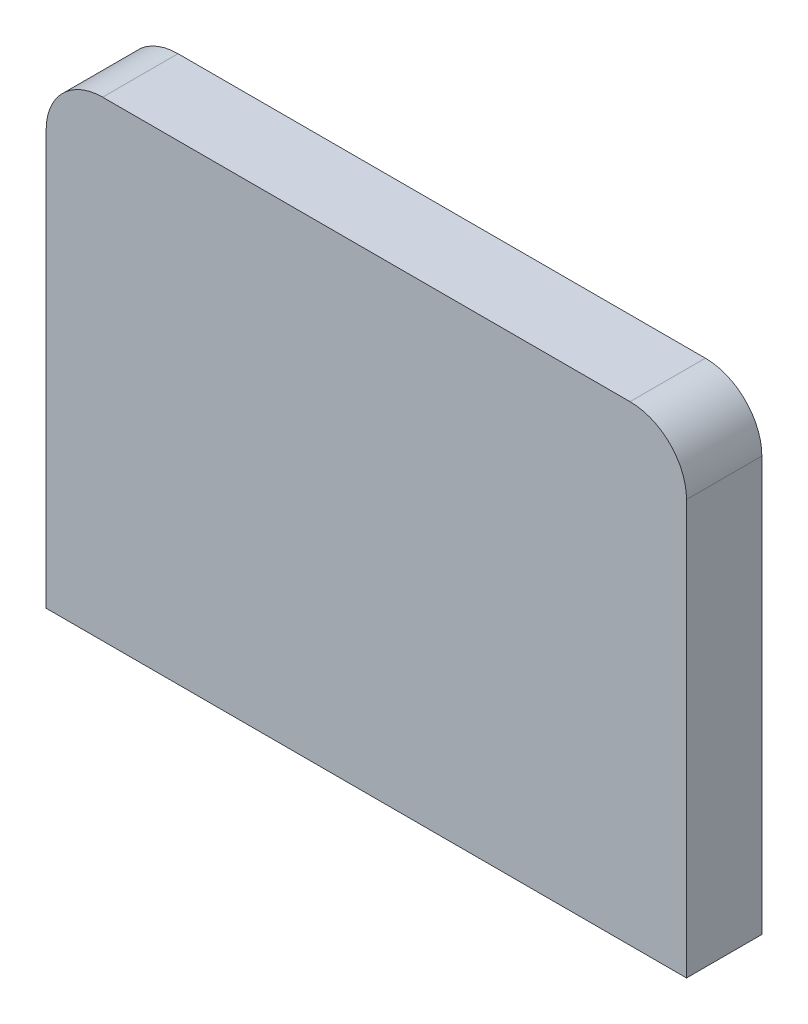
from build123d import *

# Parameters (mm, degrees)
SKETCH1_W           = 43.18
SKETCH1_H           = 31.75
BOSS_EXTRUDE1_DEPTH = 5.08
FILLET1_R           = 3.81


with BuildPart() as part:
    # Sketch1 → Boss-Extrude1 (new body)
    with BuildSketch(Plane.XY):
        with Locations((-29.043861199, 15.675265785)):
            Rectangle(SKETCH1_W, SKETCH1_H)
    extrude(amount=BOSS_EXTRUDE1_DEPTH)

    # Fillet1
    fillet1_edges = [part.edges().sort_by_distance(p)[0] for p in [
        (-50.633861199, 31.550265785, 2.54),
        (-7.453861199, 31.550265785, 2.54),
    ]]
    fillet(fillet1_edges, radius=FILLET1_R)


solid = part.part
